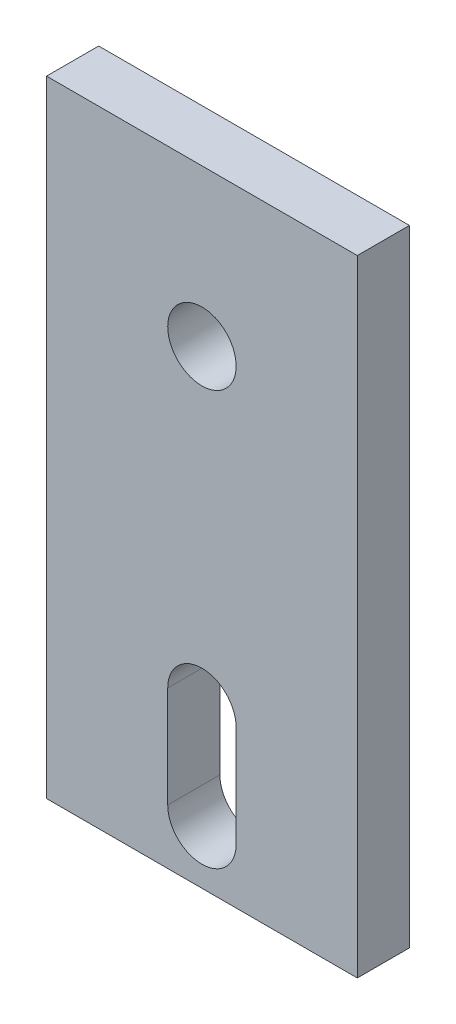
from build123d import *

# Parameters (mm, degrees)
SKETCH1_W           = 37.846
SKETCH1_H           = 76.2
SKETCH1_R           = 4.1656
BOSS_EXTRUDE1_DEPTH = 6.35
CUT_EXTRUDE1_DEPTH  = 79.770822193


with BuildPart() as part:
    # Sketch1 → Boss-Extrude1 (new body)
    with BuildSketch(Plane.XY.offset(6.35)):
        with Locations((0, 38.1)):
            Rectangle(SKETCH1_W, SKETCH1_H)
        with Locations(Location((0, 57.15, 0), (0, 0, 180))):
            Circle(SKETCH1_R, mode=Mode.SUBTRACT)
        with Locations(Location((0, 19.05, 0), (0, 0, 180))):
            Circle(SKETCH1_R, mode=Mode.SUBTRACT)
    extrude(amount=-BOSS_EXTRUDE1_DEPTH)

    # Sketch2 → Cut-Extrude1 (cut, through all)
    with BuildSketch(Plane.XY.offset(6.35)):
        with BuildLine():
            Line((-4.1656, 6.7056), (-4.1656, 19.05))
            ThreePointArc((-4.1656, 19.05), (0, 23.2156), (4.1656, 19.05))
            Line((4.1656, 19.05), (4.1656, 6.7056))
            ThreePointArc((4.1656, 6.7056), (0, 2.54), (-4.1656, 6.7056))
        make_face()
    extrude(amount=-CUT_EXTRUDE1_DEPTH, mode=Mode.SUBTRACT)


solid = part.part
